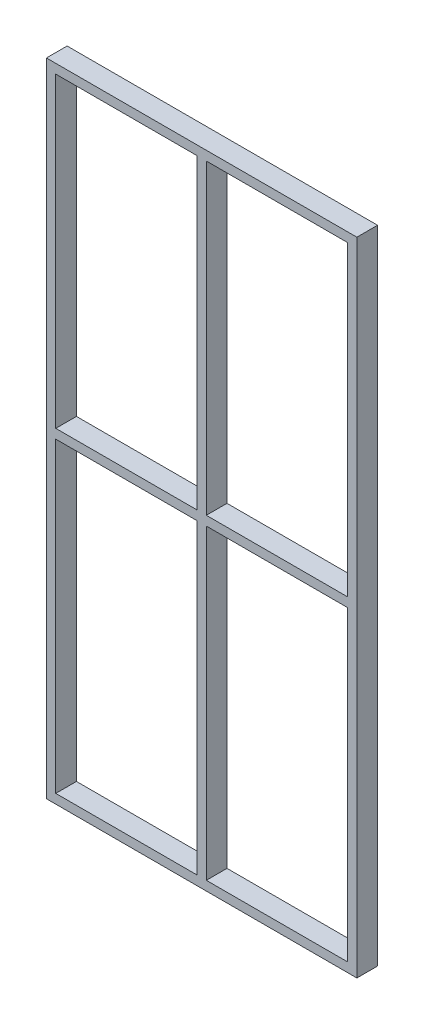
from build123d import *

# Parameters (mm, degrees)
ESQUISSE1_W        = 900
ESQUISSE1_H        = 1860
ESQUISSE1_W_2      = 846
ESQUISSE1_H_2      = 1806
EXTRU_MINCE1_DEPTH = 60
ESQUISSE2_W        = 27
ESQUISSE2_H        = 1806
EXTRU_MINCE2_DEPTH = 60
ESQUISSE3_W        = 846
ESQUISSE3_H        = 27
EXTRU_MINCE3_DEPTH = 60


with BuildPart() as part:
    # Esquisse1 → Extru.-Mince1 (new body)
    with BuildSketch(Plane.XY):
        with Locations((450, 930)):
            Rectangle(ESQUISSE1_W, ESQUISSE1_H)
        with Locations((450, 930)):
            Rectangle(ESQUISSE1_W_2, ESQUISSE1_H_2, mode=Mode.SUBTRACT)
    extrude(amount=EXTRU_MINCE1_DEPTH)

    # Esquisse2 → Extru.-Mince2 (add)
    with BuildSketch(Plane.XY.offset(60)):
        with Locations((450, 930)):
            Rectangle(ESQUISSE2_W, ESQUISSE2_H)
    extrude(amount=-EXTRU_MINCE2_DEPTH)

    # Esquisse3 → Extru.-Mince3 (add)
    with BuildSketch(Plane.XY.offset(60)):
        with Locations((450, 930)):
            Rectangle(ESQUISSE3_W, ESQUISSE3_H)
    extrude(amount=-EXTRU_MINCE3_DEPTH)


solid = part.part
